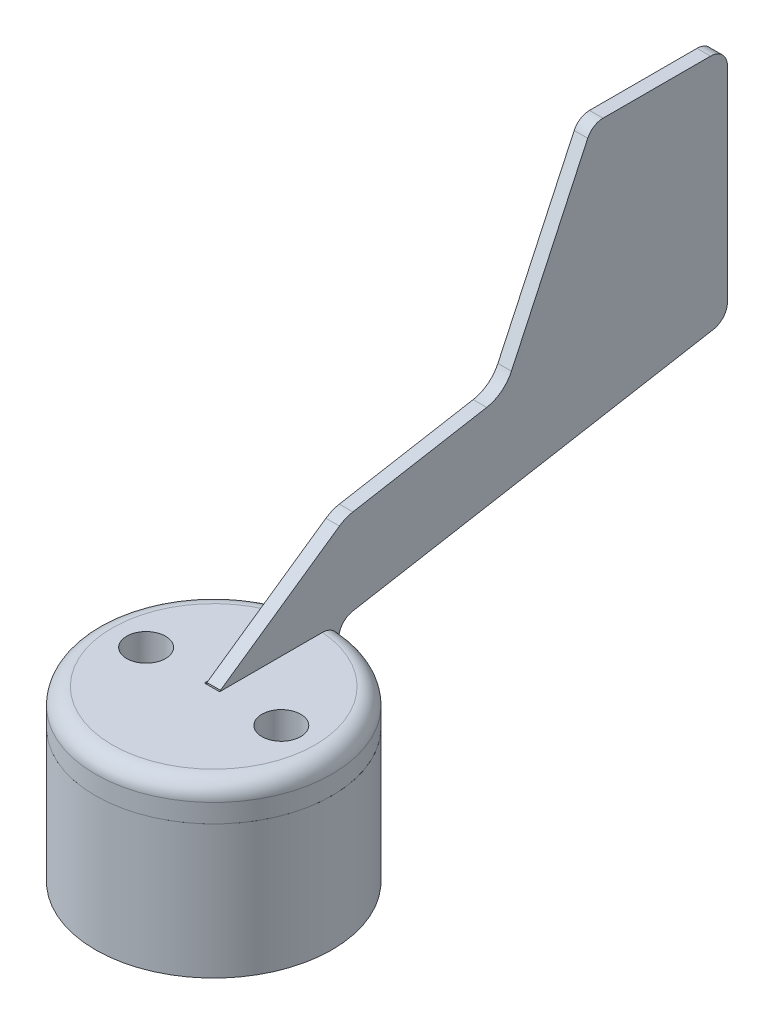
from build123d import *

# Parameters (mm, degrees)
SKETCH_1_W                     = 7
SKETCH_1_H                     = 10
CUT_EXTRUDE_1_DEPTH            = 6.5
EXTRUDE_2_DEPTH                = 0.4
SKETCH_5_W                     = 7.2
SKETCH_5_H                     = 2.2
CUT_EXTRUDE_2_DEPTH            = 0.45
FILLET_1_R                     = 1
FILLET_2_R                     = 1
SKETCH_6_R                     = 6
SKETCH_6_R_2                   = 2.8
CUT_EXTRUDE_3_DEPTH            = 6
FILLET_4_R                     = 1
FILLET_3_R                     = 2
SKETCH_8_R                     = 1
CUT_EXTRUDE_4_DEPTH            = 6
SPLIT_BODIES_1_SURFACE_1_BACK  = 49.466
SPLIT_BODIES_1_SURFACE_1_DEPTH = 98.932
SPLIT_BODIES_1_SURFACE_2_BACK  = 49.466
SPLIT_BODIES_1_SURFACE_2_DEPTH = 98.932
SKETCH_13_R                    = 1.15
CUT_EXTRUDE_6_DEPTH            = 2.8
FILLET_7_R                     = 1
SKETCH_14_W                    = 0.8
SKETCH_14_H                    = 4.22905479
EXTRUDE_3_DEPTH                = 6


with BuildPart() as part:
    # 草图1 → 旋转1 (revolve)
    with BuildSketch(Plane(origin=(0, 0, 0), x_dir=(0, 0, -1), z_dir=(1, 0, 0))):
        with Locations((3.5, 5)):
            Rectangle(SKETCH_1_W, SKETCH_1_H)
    revolve(axis=Axis((0, 0, 0), (0, 1, 0)))

    # 草图2 → 切除-拉伸1 (cut)
    with BuildSketch(Plane(origin=(0, 0, 0), x_dir=(1, 0, 0), z_dir=(0, 1, 0))):
        with BuildLine():
            Line((-1.384738242, -1.15), (1.384738242, -1.15))
            ThreePointArc((1.384738242, -1.15), (0, 1.8), (-1.384738242, -1.15))
        make_face()
    extrude(amount=CUT_EXTRUDE_1_DEPTH, mode=Mode.SUBTRACT)

    # 草图5 → 切除-拉伸2 (cut, symmetric)
    with BuildSketch(Plane(origin=(0, 0, 0), x_dir=(0, 0, -1), z_dir=(1, 0, 0))):
        with Locations((3.5, 9)):
            Rectangle(SKETCH_5_W, SKETCH_5_H)
    extrude(amount=CUT_EXTRUDE_2_DEPTH, both=True, mode=Mode.SUBTRACT)

    # 圆角1
    fillet_1_edges = [part.edges().sort_by_distance(p)[0] for p in [
        (0, 10, 7),
    ]]
    fillet(fillet_1_edges, radius=FILLET_1_R)

    # 草图6 → 切除-拉伸3 (cut)
    with BuildSketch(Plane.XZ):
        with Locations(Location((0, 0, 0), (0, 0, 270))):
            Circle(SKETCH_6_R)
        with Locations(Location((0, 0, 0), (0, 0, 270))):
            Circle(SKETCH_6_R_2, mode=Mode.SUBTRACT)
    extrude(amount=-CUT_EXTRUDE_3_DEPTH, mode=Mode.SUBTRACT)

    # 圆角4
    fillet_4_edges = [part.edges().sort_by_distance(p)[0] for p in [
        (0, 6, 6),
        (0, 6, 2.8),
    ]]
    fillet(fillet_4_edges, radius=FILLET_4_R)

    # 草图8 → 切除-拉伸4 (cut)
    with BuildSketch(Plane(origin=(0, 10, 0), x_dir=(1, 0, 0), z_dir=(0, 1, 0))):
        with Locations(Location((4, 0, 0), (0, 0, 270))):
            Circle(SKETCH_8_R)
        with Locations(Location((-4, 0, 0), (0, 0, 288.662924885))):
            Circle(SKETCH_8_R)
    extrude(amount=-CUT_EXTRUDE_4_DEPTH, mode=Mode.SUBTRACT)


with BuildPart() as body_2:
    # 草图4 → 凸台-拉伸2 (new, symmetric)
    with BuildSketch(Plane(origin=(0, 0, 0), x_dir=(0, 0, -1), z_dir=(1, 0, 0))):
        Polygon((16.777935685, 16.801246936), (22, 28), (30, 28), (30, 14.055520556), (7, 10), (7, 8), (0, 8), (0, 10), (7.400846686, 15.147813145), align=None)
    extrude(amount=EXTRUDE_2_DEPTH, both=True)

    # 圆角2
    fillet_2_edges = [body_2.edges().sort_by_distance(p)[0] for p in [
        (0, 28, -22),
        (0, 10, -7),
    ]]
    fillet(fillet_2_edges, radius=FILLET_2_R)

    # 圆角3
    fillet_3_edges = [body_2.edges().sort_by_distance(p)[0] for p in [
        (0, 15.147813145, -7.400846686),
        (0, 16.801246936, -16.777935685),
    ]]
    fillet(fillet_3_edges, radius=FILLET_3_R)

    # 圆角7
    fillet_7_edges = [body_2.edges().sort_by_distance(p)[0] for p in [
        (0, 28, -30),
        (0, 14.055520556, -30),
    ]]
    fillet(fillet_7_edges, radius=FILLET_7_R)


with BuildPart() as body_3:
    # Split Bodies 1: the piece behind the surface
    add(part.part)
    # Split Bodies 1 surface: a surface, the sketch's curves swept straight by 98.932 mm
    with BuildLine(Plane(origin=(0, 0, 0), x_dir=(0, 0, -1), z_dir=(1, 0, 0)).offset(-SPLIT_BODIES_1_SURFACE_1_BACK), mode=Mode.PRIVATE) as split_bodies_1_surface_1_path:
        Line((-7, 7.9), (7, 7.9))
    split_bodies_1_surface_1 = Shell.extrude(split_bodies_1_surface_1_path.wire(), (1 * SPLIT_BODIES_1_SURFACE_1_DEPTH, 0 * SPLIT_BODIES_1_SURFACE_1_DEPTH, 0 * SPLIT_BODIES_1_SURFACE_1_DEPTH))
    split(bisect_by=split_bodies_1_surface_1, keep=Keep.BOTTOM)

    # 草图14 → 凸台-拉伸3 (add)
    with BuildSketch(Plane.XZ):
        with Locations((0, -4.254434053)):
            Rectangle(SKETCH_14_W, SKETCH_14_H)
        with Locations((0, 4.254434053)):
            Rectangle(SKETCH_14_W, SKETCH_14_H)
    extrude(amount=-EXTRUDE_3_DEPTH)


with BuildPart() as part_1:
    add(part.part)

    # Split Bodies 1: split by a surface, the side it looks to stays
    # Split Bodies 1 surface: a surface, the sketch's curves swept straight by 98.932 mm
    with BuildLine(Plane(origin=(0, 0, 0), x_dir=(0, 0, -1), z_dir=(1, 0, 0)).offset(-SPLIT_BODIES_1_SURFACE_2_BACK), mode=Mode.PRIVATE) as split_bodies_1_surface_2_path:
        Line((-7, 7.9), (7, 7.9))
    split_bodies_1_surface_2 = Shell.extrude(split_bodies_1_surface_2_path.wire(), (1 * SPLIT_BODIES_1_SURFACE_2_DEPTH, 0 * SPLIT_BODIES_1_SURFACE_2_DEPTH, 0 * SPLIT_BODIES_1_SURFACE_2_DEPTH))
    split(bisect_by=split_bodies_1_surface_2, keep=Keep.TOP)

    # 草图13 → 切除-拉伸6 (cut)
    with BuildSketch(Plane(origin=(0, 10, 0), x_dir=(1, 0, 0), z_dir=(0, 1, 0))):
        with Locations(Location((-4, 0, 0), (0, 0, 270))):
            Circle(SKETCH_13_R)
        with Locations(Location((4, 0, 0), (0, 0, 270))):
            Circle(SKETCH_13_R)
    extrude(amount=-CUT_EXTRUDE_6_DEPTH, mode=Mode.SUBTRACT)


solid = Compound([body_2.part, body_3.part, part_1.part])
